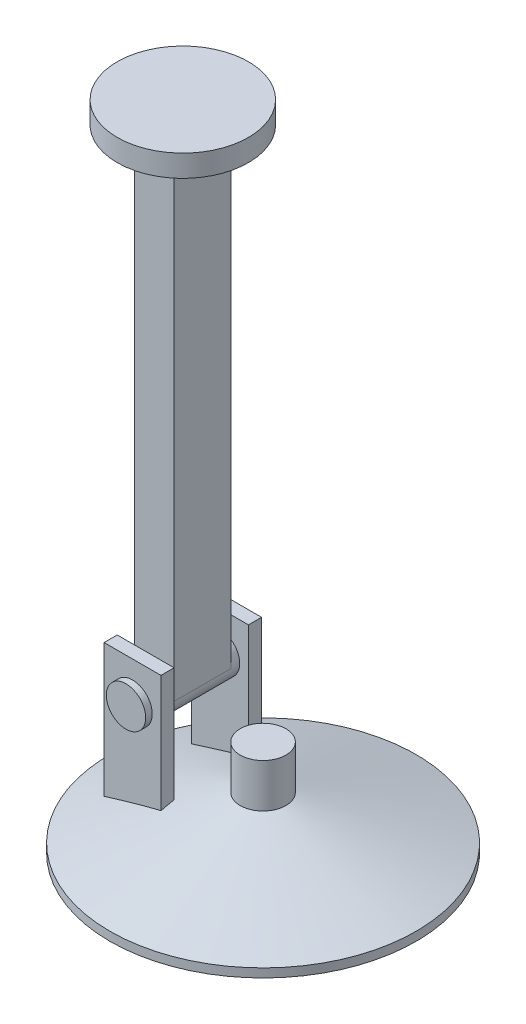
from build123d import *

# Parameters (mm, degrees)
SKETCH1_R           = 35
SKETCH2_R           = 5.224283628
SKETCH8_R           = 5.224283628
BOSS_EXTRUDE1_DEPTH = 10
SKETCH16_W          = 13
SKETCH16_H          = 33
BOSS_EXTRUDE5_DEPTH = 1.5
SKETCH19_R          = 4.5
BOSS_EXTRUDE6_DEPTH = 13
SKETCH21_W          = 9
SKETCH21_H          = 108.66
BOSS_EXTRUDE7_DEPTH = 6.5
SKETCH22_R          = 35
BOSS_EXTRUDE8_DEPTH = 2
SKETCH23_R          = 15
BOSS_EXTRUDE9_DEPTH = 5


with BuildPart() as part:
    # Sketch1 → Loft3 section 0
    with BuildSketch(Plane(origin=(0, 0, 0), x_dir=(1, 0, 0), z_dir=(0, 1, 0))):
        Circle(SKETCH1_R)
    # Sketch2 → Loft3 section 1
    with BuildSketch(Plane(origin=(0, 10, 0), x_dir=(1, 0, 0), z_dir=(0, 1, 0))):
        Circle(SKETCH2_R)
    loft()

    # Sketch8 → Boss-Extrude1 (add)
    with BuildSketch(Plane(origin=(0, 10, 0), x_dir=(1, 0, 0), z_dir=(0, 1, 0))):
        with Locations(Location((0, 0, 0), (0, 0, 90))):
            Circle(SKETCH8_R)
    extrude(amount=BOSS_EXTRUDE1_DEPTH)

    # Sketch16 → Boss-Extrude5 (add, symmetric)
    with BuildSketch(Plane.XY.offset(10)):
        with Locations((-18.340938927, 16.5)):
            Rectangle(SKETCH16_W, SKETCH16_H)
    boss_extrude5 = extrude(amount=BOSS_EXTRUDE5_DEPTH, both=True)

    # Mirror2: Boss-Extrude5 across plane
    add(boss_extrude5.mirror(Plane.XY))

    # Sketch19 → Boss-Extrude6 (add, symmetric)
    with BuildSketch(Plane.XY):
        with Locations(Location((-18.340938927, 24.342530905, 0), (0, 0, 180))):
            Circle(SKETCH19_R)
    extrude(amount=BOSS_EXTRUDE6_DEPTH, both=True)

    # Sketch21 → Boss-Extrude7 (add, symmetric)
    with BuildSketch(Plane.XY):
        with Locations((-18.340938927, 78.672530905)):
            Rectangle(SKETCH21_W, SKETCH21_H)
    extrude(amount=BOSS_EXTRUDE7_DEPTH, both=True)

    # Sketch22 → Boss-Extrude8 (add)
    with BuildSketch(Plane(origin=(0, 0, 0), x_dir=(1, 0, 0), z_dir=(0, 1, 0))):
        with Locations(Location((0, 0, 0), (0, 0, 270))):
            Circle(SKETCH22_R)
    extrude(amount=-BOSS_EXTRUDE8_DEPTH)

    # Sketch23 → Boss-Extrude9 (add)
    with BuildSketch(Plane(origin=(0, 133.002530905, 0), x_dir=(1, 0, 0), z_dir=(0, 1, 0))):
        with Locations(Location((-18.340938927, 0, 0), (0, 0, 270))):
            Circle(SKETCH23_R)
    extrude(amount=BOSS_EXTRUDE9_DEPTH)


solid = part.part
